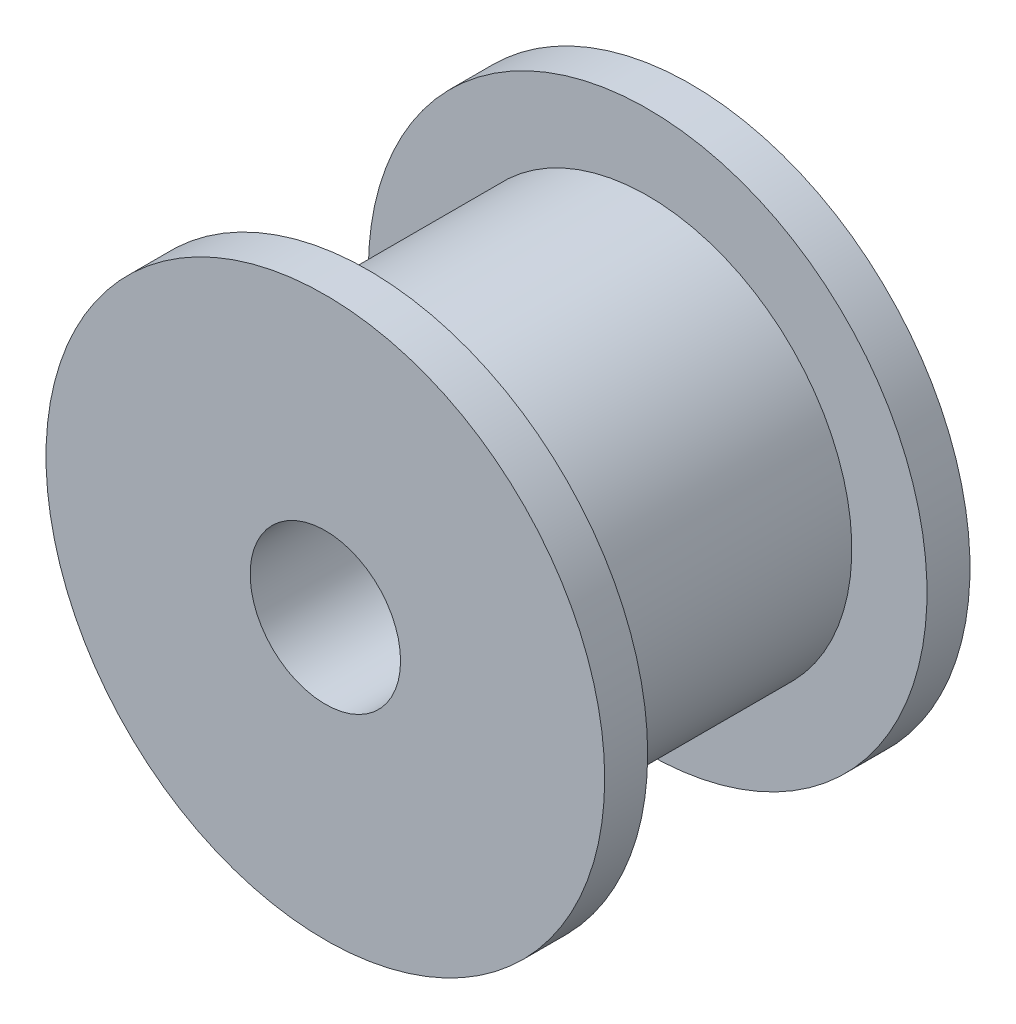
from build123d import *

# Parameters (mm, degrees)
SKETCH_1_R          = 4.75
EXTRUDE_1_DEPTH     = 6.5
SKETCH_2_R          = 6.5
EXTRUDE_2_DEPTH     = 1
EXTRUDE_START       = 1
SKETCH_3_R          = 6.5
EXTRUDE_3_DEPTH     = 1
SKETCH_4_R          = 1.75
CUT_EXTRUDE_1_DEPTH = 21


with BuildPart() as part:
    # 草图1 → 凸台-拉伸1 (new body)
    with BuildSketch(Plane.XY):
        with Locations(Location((0, 0, 0), (0, 0, 180))):
            Circle(SKETCH_1_R)
    extrude(amount=EXTRUDE_1_DEPTH)

    # 草图2 → 凸台-拉伸2 (add)
    with BuildSketch(Plane.XY.offset(6.5)):
        Circle(SKETCH_2_R)
    extrude(amount=EXTRUDE_2_DEPTH)

    # 草图3 → 凸台-拉伸3 (add)
    with BuildSketch(Plane(origin=(0, 0, 0), x_dir=(-1, 0, 0), z_dir=(0, 0, -1)).offset(EXTRUDE_START)):
        with Locations(Location((0, 0, 0), (0, 0, 180))):
            Circle(SKETCH_3_R)
    extrude(amount=-EXTRUDE_3_DEPTH)

    # 草图4 → 切除-拉伸1 (cut)
    with BuildSketch(Plane.XY.offset(7.5)):
        Circle(SKETCH_4_R)
    extrude(amount=-CUT_EXTRUDE_1_DEPTH, mode=Mode.SUBTRACT)


solid = part.part
